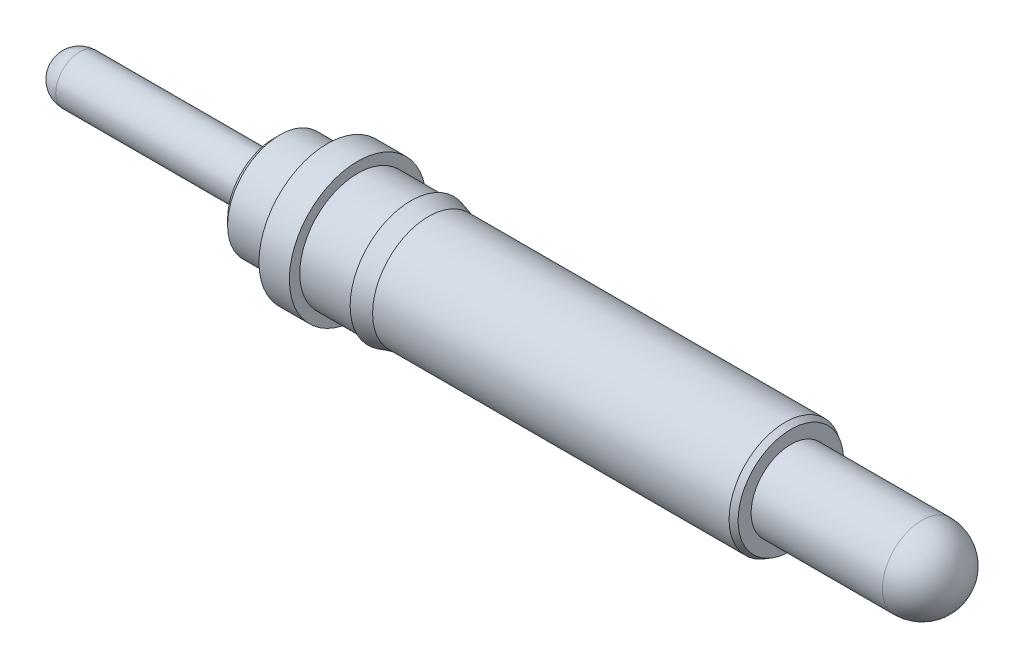
from build123d import *


with BuildPart() as part:
    # Sketch1 → Revolve1 (revolve)
    with BuildSketch(Plane.XY, mode=Mode.PRIVATE) as revolve1_sk:
        with BuildLine():
            Line((0, 0), (12.1158, 0))
            ThreePointArc((12.1158, 0), (11.960314706, 0.375374706), (11.58494, 0.53086))
            Line((11.58494, 0.53086), (9.8298, 0.53086))
            Line((9.8298, 0.53086), (9.8298, 0.705305909))
            Line((9.8298, 0.705305909), (9.7536, 0.7493))
            Line((9.7536, 0.7493), (4.986785226, 0.7493))
            Line((4.986785226, 0.7493), (4.7498, 0.8128))
            Line((4.7498, 0.8128), (4.7498, 0.7747))
            Line((4.7498, 0.7747), (4.0386, 0.7747))
            Line((4.0386, 0.7747), (4.0386, 0.9144))
            Line((4.0386, 0.9144), (3.6322, 0.9144))
            Line((3.6322, 0.9144), (3.6322, 0.6985))
            Line((3.6322, 0.6985), (2.9972, 0.6985))
            Line((2.9972, 0.6985), (2.921, 0.6223))
            Line((2.921, 0.6223), (2.921, 0.3175))
            Line((2.921, 0.3175), (0.3175, 0.3175))
            ThreePointArc((0.3175, 0.3175), (0.092993597, 0.224506403), (0, 0))
        make_face()
    revolve(revolve1_sk.sketch.rotate(Axis((0, 0, 0), (1, 0, 0)), 90), axis=Axis((0, 0, 0), (1, 0, 0)))


solid = part.part
